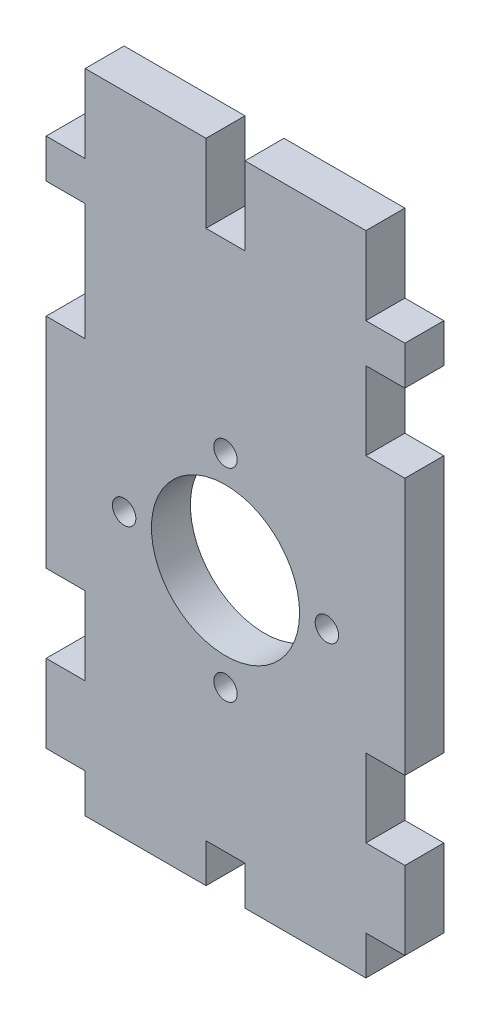
from build123d import *

# Parameters (mm, degrees)
ESQUISSE1_W             = 46
ESQUISSE1_H             = 73
ESQUISSE1_R             = 9.5
BOSS_EXTRU_1_DEPTH      = 5
ESQUISSE2_R             = 1.5
ESQUISSE2_W             = 5
ESQUISSE2_H             = 10
ESQUISSE2_H_2           = 5
ESQUISSE2_H_3           = 15
ENL_V_MAT_EXTRU_1_DEPTH = 5
ESQUISSE3_W             = 15.5
ESQUISSE3_H             = 5
BOSS_EXTRU_2_DEPTH      = 5


with BuildPart() as part:
    # Esquisse1 → Boss.-Extru.1 (new body)
    with BuildSketch(Plane.XY):
        with Locations((23, 36.5)):
            Rectangle(ESQUISSE1_W, ESQUISSE1_H)
        with Locations((23, 31.275)):
            Circle(ESQUISSE1_R, mode=Mode.SUBTRACT)
    extrude(amount=BOSS_EXTRU_1_DEPTH)

    # Esquisse2 → Enlèv. mat.-Extru.1 (cut)
    with BuildSketch(Plane.XY.offset(5)):
        with Locations((23, 44.275)):
            Circle(ESQUISSE2_R)
        with Locations((36, 31.275)):
            Circle(ESQUISSE2_R)
        with Locations((23, 18.275)):
            Circle(ESQUISSE2_R)
        with Locations((10, 31.275)):
            Circle(ESQUISSE2_R)
        with Locations((43.5, 58)):
            Rectangle(ESQUISSE2_W, ESQUISSE2_H)
        with Locations((2.5, 70.5)):
            Rectangle(ESQUISSE2_W, ESQUISSE2_H_2)
        with Locations((43.5, 15)):
            Rectangle(ESQUISSE2_W, ESQUISSE2_H)
        with Locations((2.5, 15)):
            Rectangle(ESQUISSE2_W, ESQUISSE2_H)
        with Locations((2.5, 55.5)):
            Rectangle(ESQUISSE2_W, ESQUISSE2_H_3)
        with Locations((43.5, 70.5)):
            Rectangle(ESQUISSE2_W, ESQUISSE2_H_2)
        with Locations((23, 70.5)):
            Rectangle(ESQUISSE2_W, ESQUISSE2_H_2)
    extrude(amount=-ENL_V_MAT_EXTRU_1_DEPTH, mode=Mode.SUBTRACT)

    # Esquisse3 → Boss.-Extru.2 (add)
    with BuildSketch(Plane(origin=(0, 0, 0), x_dir=(-1, 0, 0), z_dir=(0, 0, -1))):
        with Locations((-33.25, 75.5)):
            Rectangle(ESQUISSE3_W, ESQUISSE3_H)
        with Locations((-12.75, 75.5)):
            Rectangle(ESQUISSE3_W, ESQUISSE3_H)
        with Locations((-33.25, -2.5)):
            Rectangle(ESQUISSE3_W, ESQUISSE3_H)
        with Locations((-12.75, -2.5)):
            Rectangle(ESQUISSE3_W, ESQUISSE3_H)
    extrude(amount=-BOSS_EXTRU_2_DEPTH)


solid = part.part
